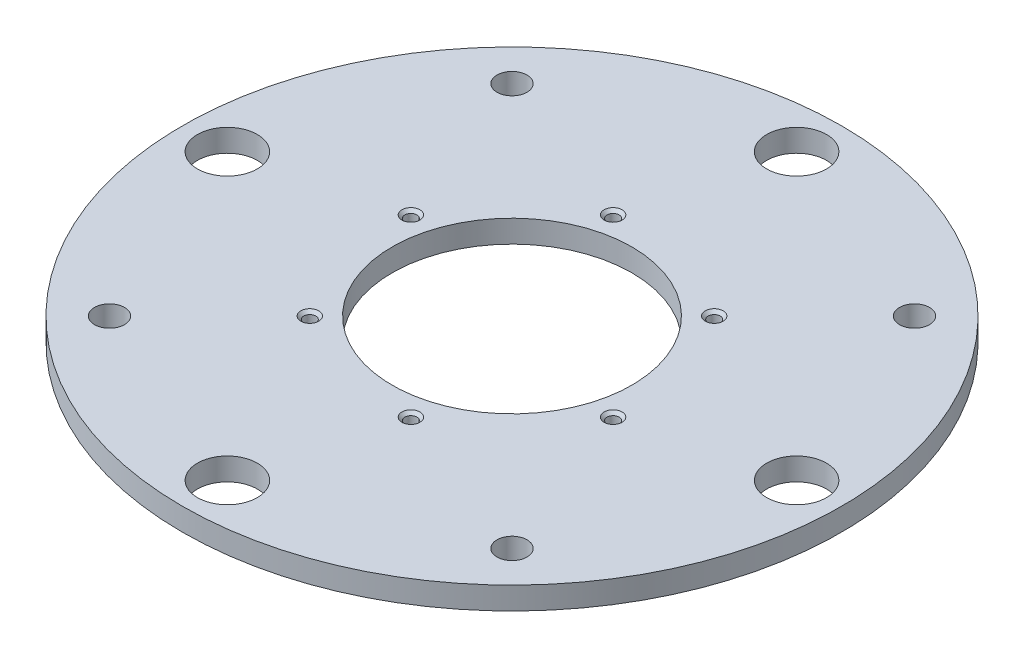
from build123d import *

# Parameters (mm, degrees)
SKETCH2_R                        = 139.7
SKETCH2_R_2                      = 50.8
BOSS_EXTRUDE1_DEPTH              = 9.525
SKETCH3_R                        = 12.6746
SKETCH3_R_2                      = 6.35
CUT_EXTRUDE2_DEPTH               = 198.795110215
F_1_4_20_TAPPED_HOLE1_AT_2_COUNT = 2
F_1_4_20_TAPPED_HOLE1_AT_2_PITCH = 60.61075
F_1_4_20_TAPPED_HOLE1_AT_3_COUNT = 2
F_1_4_20_TAPPED_HOLE1_AT_3_PITCH = 104.980898485
F_1_4_20_TAPPED_HOLE1_AT_4_COUNT = 2
F_1_4_20_TAPPED_HOLE1_AT_4_PITCH = 121.2215
F_1_4_20_TAPPED_HOLE1_AT_5_COUNT = 2
F_1_4_20_TAPPED_HOLE1_AT_5_PITCH = 104.980898485
F_1_4_20_TAPPED_HOLE1_AT_6_COUNT = 2
F_1_4_20_TAPPED_HOLE1_AT_6_PITCH = 60.61075


with BuildPart() as part:
    # Sketch2 → Boss-Extrude1 (new body)
    with BuildSketch(Plane(origin=(0, 0, 0), x_dir=(1, 0, 0), z_dir=(0, 1, 0))):
        with Locations(Location((0, 0, 0), (0, 0, 90))):
            Circle(SKETCH2_R)
        with Locations(Location((0, 0, 0), (0, 0, 90))):
            Circle(SKETCH2_R_2, mode=Mode.SUBTRACT)
    extrude(amount=BOSS_EXTRUDE1_DEPTH)

    # Sketch3 → Cut-Extrude2 (cut, through all)
    with BuildSketch(Plane(origin=(0, 9.525, 0), x_dir=(1, 0, 0), z_dir=(0, 1, 0))):
        with Locations(Location((0, 120.65, 0), (0, 0, 270))):
            Circle(SKETCH3_R)
        with Locations(Location((120.65, 0, 0), (0, 0, 270))):
            Circle(SKETCH3_R)
        with Locations(Location((0, -120.65, 0), (0, 0, 270))):
            Circle(SKETCH3_R)
        with Locations(Location((-120.65, 0, 0), (0, 0, 270))):
            Circle(SKETCH3_R)
        with Locations(Location((85.31243315, 85.31243315, 0), (0, 0, 270))):
            Circle(SKETCH3_R_2)
        with Locations(Location((85.31243315, -85.31243315, 0), (0, 0, 270))):
            Circle(SKETCH3_R_2)
        with Locations(Location((-85.31243315, -85.31243315, 0), (0, 0, 270))):
            Circle(SKETCH3_R_2)
        with Locations(Location((-85.31243315, 85.31243315, 0), (0, 0, 270))):
            Circle(SKETCH3_R_2)
    extrude(amount=-CUT_EXTRUDE2_DEPTH, mode=Mode.SUBTRACT)

    # Sketch6 → 1/4-20 Tapped Hole1 (revolve, cut)
    with BuildSketch(Plane(origin=(-58.545488776, 9.525, -15.687216438), x_dir=(0, 0, 1), z_dir=(1, 0, 0))):
        Polygon((0, 0), (0, 9.525), (3.81, 9.525), (2.5527, 8.2677), (2.5527, 1.2573), (3.81, 0), align=None)
    f_1_4_20_tapped_hole1 = revolve(axis=Axis((-58.545488776, 15.875, -15.687216438), (0, -1, 0)), mode=Mode.SUBTRACT)

    # 1/4-20 Tapped Hole1 at 2: 1/4-20 Tapped Hole1 ×2
    with Locations(*[Vector(0.707106781186523, 0, -0.7071067811865721) * (i * F_1_4_20_TAPPED_HOLE1_AT_2_PITCH) for i in range(1, F_1_4_20_TAPPED_HOLE1_AT_2_COUNT)]):
        add(f_1_4_20_tapped_hole1, mode=Mode.SUBTRACT)

    # 1/4-20 Tapped Hole1 at 3: 1/4-20 Tapped Hole1 ×2
    with Locations(*[Vector(0.9659258262890614, 0, -0.2588190451025464) * (i * F_1_4_20_TAPPED_HOLE1_AT_3_PITCH) for i in range(1, F_1_4_20_TAPPED_HOLE1_AT_3_COUNT)]):
        add(f_1_4_20_tapped_hole1, mode=Mode.SUBTRACT)

    # 1/4-20 Tapped Hole1 at 4: 1/4-20 Tapped Hole1 ×2
    with Locations(*[Vector(0.9659258262890731, 0, 0.258819045102503) * (i * F_1_4_20_TAPPED_HOLE1_AT_4_PITCH) for i in range(1, F_1_4_20_TAPPED_HOLE1_AT_4_COUNT)]):
        add(f_1_4_20_tapped_hole1, mode=Mode.SUBTRACT)

    # 1/4-20 Tapped Hole1 at 5: 1/4-20 Tapped Hole1 ×2
    with Locations(*[Vector(0.7071067811865548, 0, 0.7071067811865402) * (i * F_1_4_20_TAPPED_HOLE1_AT_5_PITCH) for i in range(1, F_1_4_20_TAPPED_HOLE1_AT_5_COUNT)]):
        add(f_1_4_20_tapped_hole1, mode=Mode.SUBTRACT)

    # 1/4-20 Tapped Hole1 at 6: 1/4-20 Tapped Hole1 ×2
    with Locations(*[Vector(0.25881904510251946, 0, 0.9659258262890686) * (i * F_1_4_20_TAPPED_HOLE1_AT_6_PITCH) for i in range(1, F_1_4_20_TAPPED_HOLE1_AT_6_COUNT)]):
        add(f_1_4_20_tapped_hole1, mode=Mode.SUBTRACT)


solid = part.part
